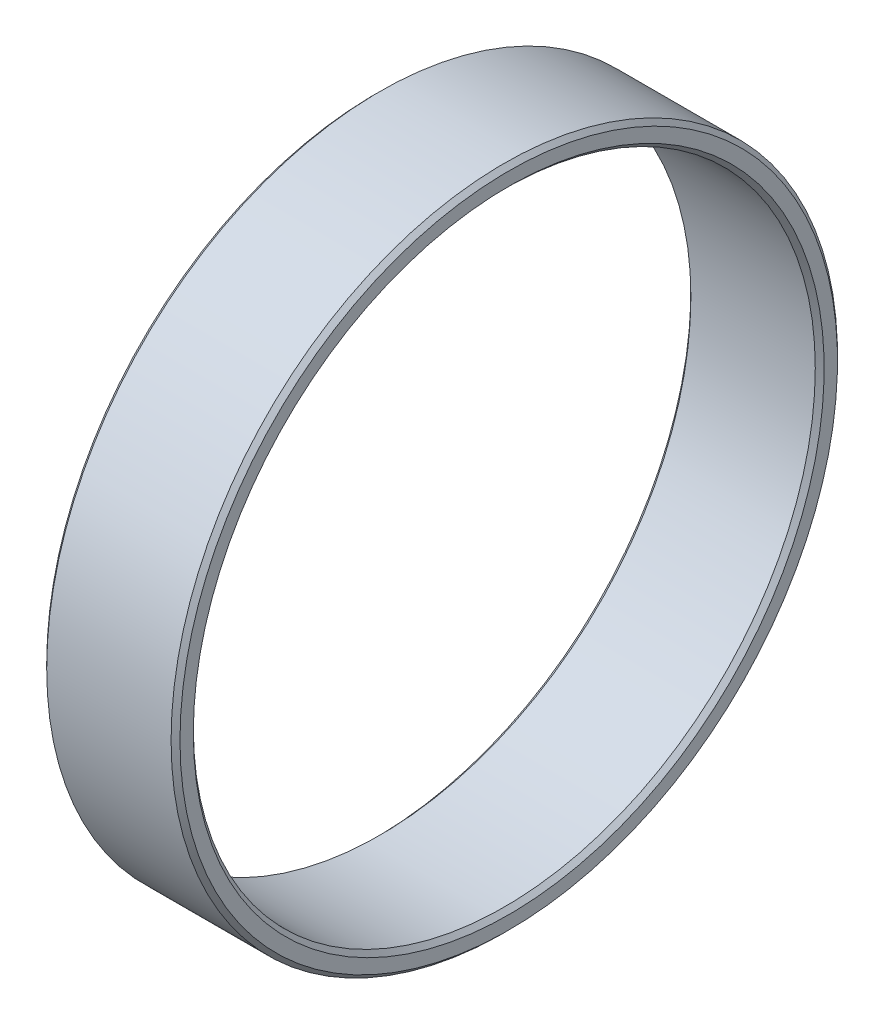
from build123d import *


with BuildPart() as part:
    # Sketch1 → Revolve1 (revolve)
    with BuildSketch(Plane.XY, mode=Mode.PRIVATE) as revolve1_sk:
        Polygon((0, 37), (0.5, 37.5), (14.5, 37.5), (15, 37), (15, 35.5), (14.5, 35), (0.5, 35), (0, 35.5), align=None)
    revolve(revolve1_sk.sketch.rotate(Axis((0, 0, 0), (1, 0, 0)), 90), axis=Axis((0, 0, 0), (1, 0, 0)))


solid = part.part
